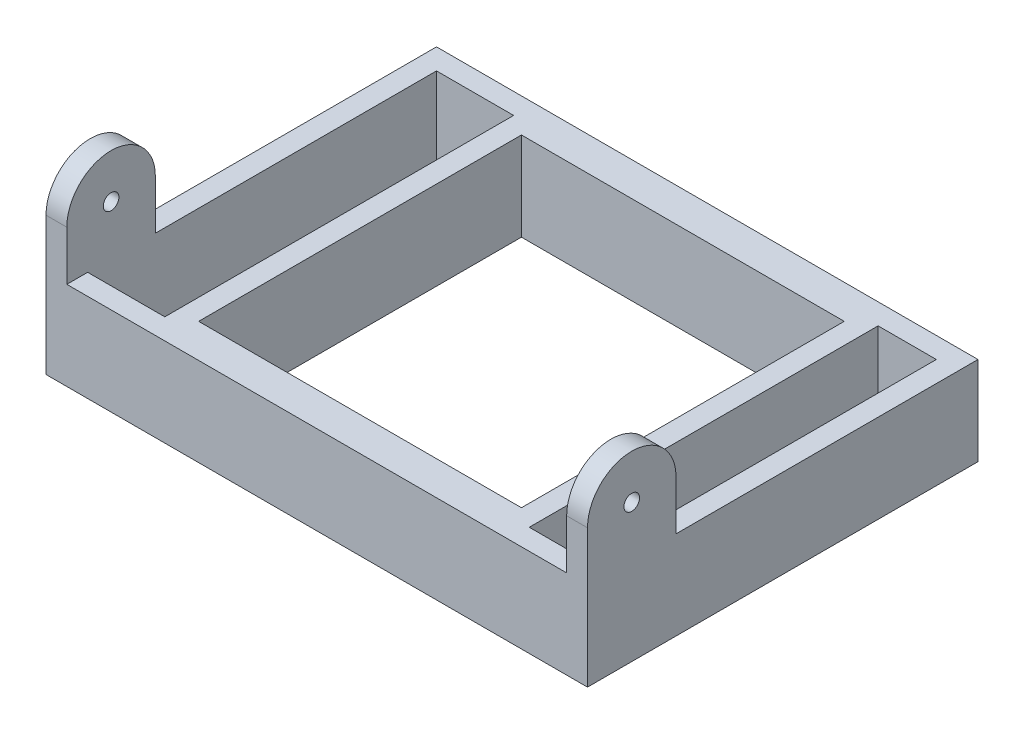
from build123d import *

# Parameters (mm, degrees)
SKETCH_1_W          = 104
SKETCH_1_H          = 75
SKETCH_1_W_2        = 14.813912832
SKETCH_1_H_2        = 67
SKETCH_1_W_3        = 62
SKETCH_1_H_3        = 62
SKETCH_1_W_4        = 11.186087168
EXTRUDE_3_DEPTH     = 17
SKETCH_3_W          = 4
SKETCH_3_H          = 17
EXTRUDE_4_DEPTH     = 18
SKETCH_4_R          = 1.5
CUT_EXTRUDE_2_DEPTH = 150


with BuildPart() as part:
    # 草图1 → 凸台-拉伸3 (new body)
    with BuildSketch(Plane(origin=(0, 0, 0), x_dir=(1, 0, 0), z_dir=(0, 1, 0))):
        with Locations((27.017596878, 29.599337879)):
            Rectangle(SKETCH_1_W, SKETCH_1_H)
        with Locations((-13.575446706, 29.599337879)):
            Rectangle(SKETCH_1_W_2, SKETCH_1_H_2, mode=Mode.SUBTRACT)
        with Locations((28.83150971, 29.599337879)):
            Rectangle(SKETCH_1_W_3, SKETCH_1_H_3, mode=Mode.SUBTRACT)
        with Locations((69.424553294, 29.599337879)):
            Rectangle(SKETCH_1_W_4, SKETCH_1_H_2, mode=Mode.SUBTRACT)
    extrude(amount=EXTRUDE_3_DEPTH)

    # 草图3 → 凸台-拉伸4 (add)
    with BuildSketch(Plane(origin=(0, 17, 0), x_dir=(1, 0, 0), z_dir=(0, 1, 0))):
        with Locations((-22.982403122, 0.599337879)):
            Rectangle(SKETCH_3_W, SKETCH_3_H)
        with Locations((77.017596878, 0.599337879)):
            Rectangle(SKETCH_3_W, SKETCH_3_H)
    extrude(amount=EXTRUDE_4_DEPTH)

    # 草图4 → 切除-拉伸2 (cut)
    with BuildSketch(Plane.ZY.offset(24.982403122)):
        with BuildLine():
            Line((-9.099337879, 35), (-9.099337879, 26.5))
            ThreePointArc((-9.099337879, 26.5), (-6.609745519, 32.51040764), (-0.599337879, 35))
            Line((-0.599337879, 35), (-9.099337879, 35))
        make_face()
        with BuildLine():
            Line((7.900662121, 35), (-0.599337879, 35))
            ThreePointArc((-0.599337879, 35), (5.411069761, 32.51040764), (7.900662121, 26.5))
            Line((7.900662121, 26.5), (7.900662121, 35))
        make_face()
        with Locations((-0.599337879, 26.5)):
            Circle(SKETCH_4_R)
    extrude(amount=-CUT_EXTRUDE_2_DEPTH, mode=Mode.SUBTRACT)


solid = part.part
